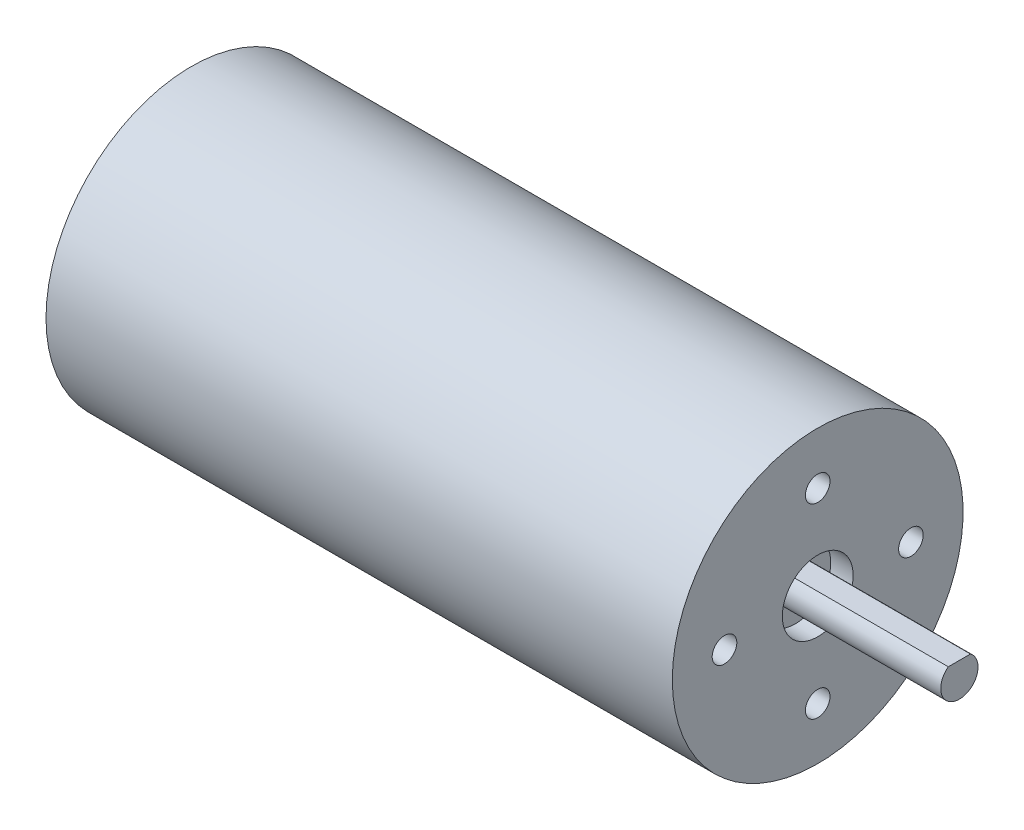
from build123d import *

# Parameters (mm, degrees)
SKETCH1_R                       = 19.5
BOSS_EXTRUDE1_DEPTH             = 42
SKETCH2_R                       = 4.75
CUT_EXTRUDE1_DEPTH              = 3
BOSS_EXTRUDE2_DEPTH             = 22
TAP_DRILL_FOR_M4X0_7_TAP1_D     = 3.3
TAP_DRILL_FOR_M4X0_7_TAP1_DEPTH = 10.0000054
TAP_DRILL_FOR_M4X0_7_TAP1_TIP   = 0.991420021
SKETCH6_R                       = 3.5
CUT_EXTRUDE2_DEPTH              = 1.33


with BuildPart() as part:
    # Sketch1 → Boss-Extrude1 (new, symmetric)
    with BuildSketch(Plane(origin=(0, 0, 0), x_dir=(0, 0, -1), z_dir=(1, 0, 0))):
        with Locations(Location((0, 0, 0), (0, 0, 180))):
            Circle(SKETCH1_R)
    extrude(amount=BOSS_EXTRUDE1_DEPTH, both=True)

    # Sketch2 → Cut-Extrude1 (cut)
    with BuildSketch(Plane(origin=(42, 0, 0), x_dir=(0, 0, -1), z_dir=(1, 0, 0))):
        Circle(SKETCH2_R)
    extrude(amount=-CUT_EXTRUDE1_DEPTH, mode=Mode.SUBTRACT)

    # Sketch3 → Boss-Extrude2 (add)
    with BuildSketch(Plane(origin=(39, 0, 0), x_dir=(0, 0, -1), z_dir=(1, 0, 0))):
        with BuildLine():
            Line((-1.486573241, 2.01), (1.486573241, 2.01))
            ThreePointArc((1.486573241, 2.01), (0, -2.5), (-1.486573241, 2.01))
        make_face()
    extrude(amount=BOSS_EXTRUDE2_DEPTH)

    # Tap Drill for M4x0.7 Tap1
    with Locations(Plane(origin=(42, 0, 0), x_dir=(0, 0, -1), z_dir=(1, 0, 0))):
        with Locations((0, 12.5), (12.5, 0), (0, -12.5), (-12.5, 0)):
            Hole(TAP_DRILL_FOR_M4X0_7_TAP1_D / 2, depth=TAP_DRILL_FOR_M4X0_7_TAP1_DEPTH)
            with Locations((0, 0, -(TAP_DRILL_FOR_M4X0_7_TAP1_DEPTH + TAP_DRILL_FOR_M4X0_7_TAP1_TIP / 2))):  # 118° drill point
                Cone(0, TAP_DRILL_FOR_M4X0_7_TAP1_D / 2, TAP_DRILL_FOR_M4X0_7_TAP1_TIP, mode=Mode.SUBTRACT)

    # Sketch6 → Cut-Extrude2 (cut)
    with BuildSketch(Plane.ZY.offset(42)):
        Circle(SKETCH6_R)
        with BuildLine():
            Line((-2.185, 17.03), (2.185, 17.03))
            ThreePointArc((2.185, 17.03), (5.755, 13.46), (2.185, 9.89))
            Line((2.185, 9.89), (-2.185, 9.89))
            ThreePointArc((-2.185, 9.89), (-5.755, 13.46), (-2.185, 17.03))
        make_face()
    extrude(amount=-CUT_EXTRUDE2_DEPTH, mode=Mode.SUBTRACT)


solid = part.part
